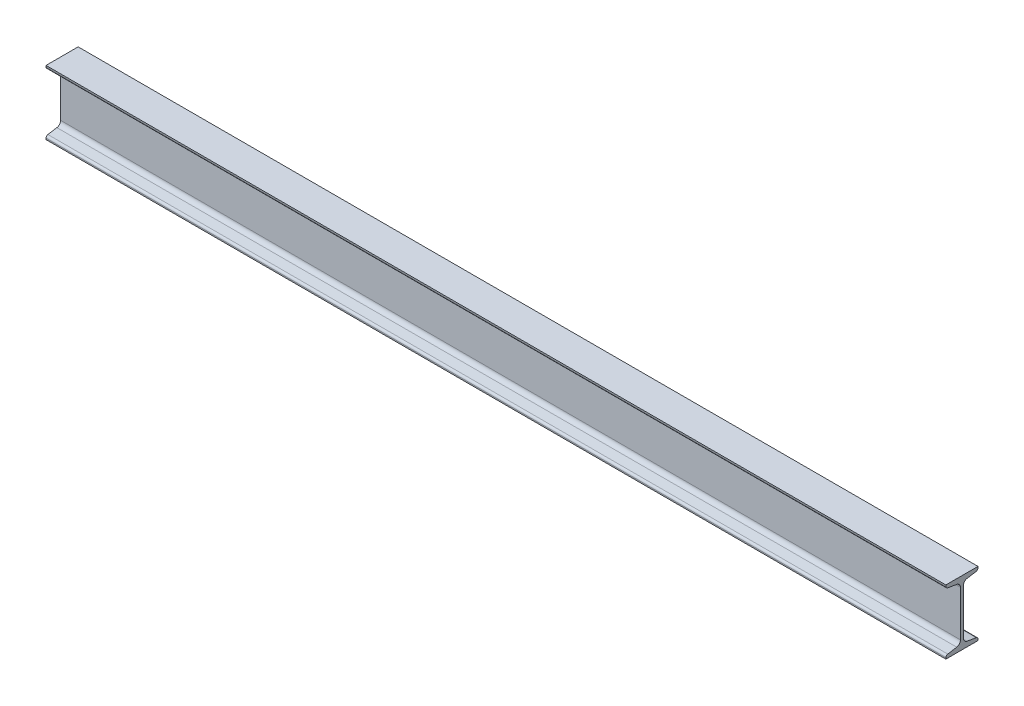
from build123d import *

# Parameters (mm, degrees)
VIGA_SB_100_X_8_2_DEPTH = 1400


with BuildPart() as part:
    # Sketch14 → Viga sb 100 X 8(2) (new body)
    with BuildSketch(Plane(origin=(0, 0, 0), x_dir=(0, 0, 1), z_dir=(1, 0, 0))):
        with BuildLine():
            Line((-25, -50), (-25, -48.060671023))
            ThreePointArc((-25, -48.060671023), (-24.17058332, -45.798374682), (-22.075437296, -44.608299096))
            Line((-22.075437296, -44.608299096), (-8.099125408, -42.278743853))
            ThreePointArc((-8.099125408, -42.278743853), (-3.90883336, -39.898592681), (-2.25, -35.374))
            Line((-2.25, -35.374), (-2.25, 35.374))
            ThreePointArc((-2.25, 35.374), (-3.90883336, 39.898592681), (-8.099125408, 42.278743853))
            Line((-8.099125408, 42.278743853), (-22.075437296, 44.608299096))
            ThreePointArc((-22.075437296, 44.608299096), (-24.17058332, 45.798374682), (-25, 48.060671023))
            Line((-25, 48.060671023), (-25, 50))
            Line((-25, 50), (25, 50))
            Line((25, 50), (25, 48.060671023))
            ThreePointArc((25, 48.060671023), (24.17058332, 45.798374682), (22.075437296, 44.608299096))
            Line((22.075437296, 44.608299096), (8.099125408, 42.278743853))
            ThreePointArc((8.099125408, 42.278743853), (3.90883336, 39.898592681), (2.25, 35.374))
            Line((2.25, 35.374), (2.25, -35.374))
            ThreePointArc((2.25, -35.374), (3.90883336, -39.898592681), (8.099125408, -42.278743853))
            Line((8.099125408, -42.278743853), (22.075437296, -44.608299096))
            ThreePointArc((22.075437296, -44.608299096), (24.17058332, -45.798374682), (25, -48.060671023))
            Line((25, -48.060671023), (25, -50))
            Line((25, -50), (-25, -50))
        make_face()
    extrude(amount=VIGA_SB_100_X_8_2_DEPTH)


solid = part.part
